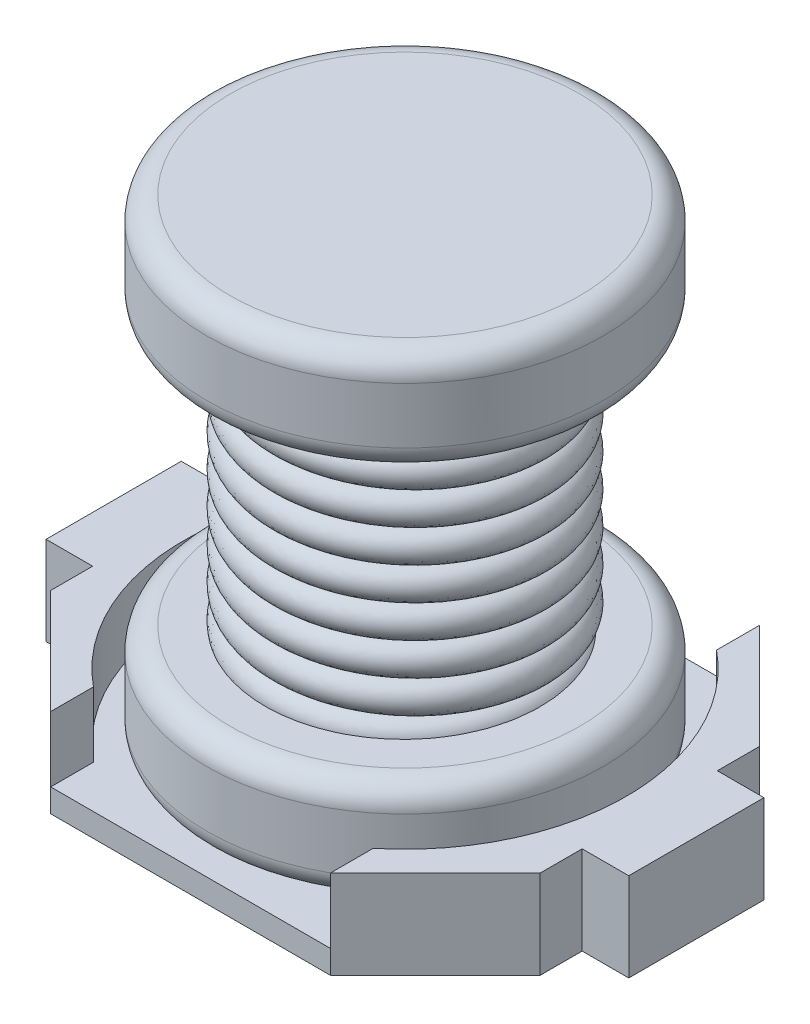
from build123d import *

# Parameters (mm, degrees)
CROQUIS1_W            = 10.5
CROQUIS1_H            = 9.2
EXTRUIR1_DEPTH        = 1.9
CROQUIS2_W            = 6
CROQUIS2_H            = 1.4
CORTAR_EXTRUIR1_DEPTH = 13.9
CROQUIS3_W            = 1
CROQUIS3_H            = 2.9
EXTRUIR2_DEPTH        = 1.9
CORTAR_EXTRUIR2_DEPTH = 4.9
CROQUIS5_R            = 4.75
CORTAR_EXTRUIR4_DEPTH = 4.9
BARRER1_PITCH         = 0.7
BARRER1_HEIGHT        = 5.6
BARRER1_RADIUS        = 2.75900428
BARRER1_START_ANGLE   = -180
CROQUIS8_R            = 0.342126569
REDONDEO1_R           = 0.5


with BuildPart() as part:
    # Croquis1 → Extruir1 (new body)
    with BuildSketch(Plane(origin=(0, 0, 0), x_dir=(1, 0, 0), z_dir=(0, 1, 0))):
        Rectangle(CROQUIS1_W, CROQUIS1_H)
    extrude(amount=EXTRUIR1_DEPTH)

    # Croquis2 → Cortar-Extruir1 (cut)
    with BuildSketch(Plane.XY.offset(4.6)):
        with Locations((0, 1.2)):
            Rectangle(CROQUIS2_W, CROQUIS2_H)
    extrude(amount=-CORTAR_EXTRUIR1_DEPTH, mode=Mode.SUBTRACT)

    # Croquis3 → Extruir2 (add)
    with BuildSketch(Plane(origin=(0, 1.9, 0), x_dir=(1, 0, 0), z_dir=(0, 1, 0))):
        with Locations((5.75, 0)):
            Rectangle(CROQUIS3_W, CROQUIS3_H)
        with Locations((-5.75, 0)):
            Rectangle(CROQUIS3_W, CROQUIS3_H)
    extrude(amount=-EXTRUIR2_DEPTH)

    # Croquis4 → Cortar-Extruir2 (cut)
    with BuildSketch(Plane(origin=(0, 1.9, 0), x_dir=(1, 0, 0), z_dir=(0, 1, 0))):
        Polygon((-3, 4.6), (-5.25, 2.35), (-6.161497734, 2.35), (-6.161497734, 5.064836166), (-3, 5.064836166), align=None)
        Polygon((3, 5.064836166), (3, 4.6), (5.25, 2.35), (6.161497734, 2.35), (6.161497734, 5.064836166), align=None)
        Polygon((3, -4.6), (5.25, -2.35), (6.161497734, -2.35), (6.161497734, -5.064836166), (3, -5.064836166), align=None)
        Polygon((-3, -5.064836166), (-3, -4.6), (-5.25, -2.35), (-6.161497734, -2.35), (-6.161497734, -5.064836166), align=None)
    extrude(amount=-CORTAR_EXTRUIR2_DEPTH, mode=Mode.SUBTRACT)

    # Croquis5 → Cortar-Extruir4 (cut)
    with BuildSketch(Plane(origin=(0, 0.5, 0), x_dir=(1, 0, 0), z_dir=(0, 1, 0))):
        Circle(CROQUIS5_R)
    extrude(amount=CORTAR_EXTRUIR4_DEPTH, mode=Mode.SUBTRACT)


with BuildPart() as body_2:
    # Croquis6 → Revolución1 (revolve)
    with BuildSketch(Plane(origin=(0, 0, 0), x_dir=(0, 0, -1), z_dir=(1, 0, 0)), mode=Mode.PRIVATE) as revoluci_n1_sk:
        Polygon((0, 0.5), (0, 10.7), (4.25, 10.7), (4.25, 8.5), (2.25, 8.5), (2.25, 2.7), (4.25, 2.7), (4.25, 0.5), align=None)
    revolve(revoluci_n1_sk.sketch.rotate(Axis((0, 0.5, 0), (0, -1, 0)), 180), axis=Axis((0, 0.5, 0), (0, -1, 0)))

    # Redondeo1
    redondeo1_edges = [body_2.edges().sort_by_distance(p)[0] for p in [
        (0, 10.7, -4.25),
        (0, 8.5, -4.25),
        (0, 2.7, -4.25),
        (0, 0.5, -4.25),
    ]]
    fillet(redondeo1_edges, radius=REDONDEO1_R)


with BuildPart() as body_3:
    # Barrer1: sweep along a helix
    with BuildLine() as barrer1_path:
        add(Helix(BARRER1_PITCH, BARRER1_HEIGHT, BARRER1_RADIUS, center=(0, 2.7, 0), direction=(0, 1, 0), lefthand=True, mode=Mode.PRIVATE).rotate(Axis((0, 2.7, 0), (0, 1, 0)), BARRER1_START_ANGLE))
    # Croquis8 → Barrer1 (sweep)
    with BuildSketch(Plane(origin=(0, 0, 0), x_dir=(0, 0, -1), z_dir=(1, 0, 0))):
        with Locations((2.661711681, 3.05996706)):
            Circle(CROQUIS8_R)
    sweep(path=barrer1_path.line, is_frenet=True)


solid = Compound([part.part, body_2.part, body_3.part])
